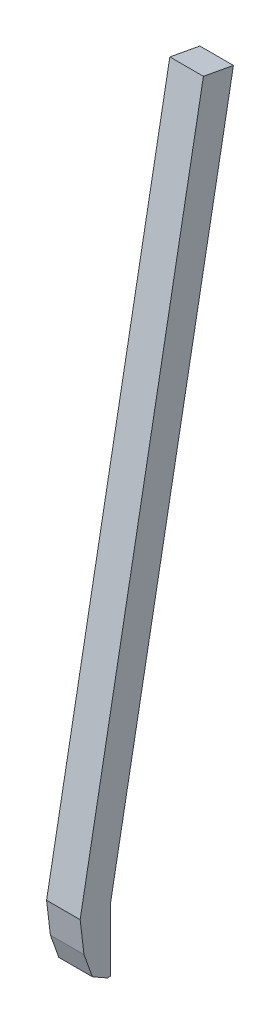
from build123d import *

# Parameters (mm, degrees)
SKETCH3_W                = 11
SKETCH3_H                = 21
BOSS_EXTRUDE1_DEPTH      = 10
CUT_EXTRUDE1_DEPTH       = 8
CUT_EXTRUDE5_DEPTH       = 8
CUT_EXTRUDE5_DEPTH_BACK  = 8
BOSS_EXTRUDE2_DEPTH      = 5.5
BOSS_EXTRUDE2_DEPTH_BACK = 5.5


with BuildPart() as part:
    # Sketch3 → Boss-Extrude1 (new body)
    with BuildSketch(Plane.XY):
        Rectangle(SKETCH3_W, SKETCH3_H)
    extrude(amount=BOSS_EXTRUDE1_DEPTH)

    # Sketch5 → Cut-Extrude1 (cut)
    with BuildSketch(Plane.XY):
        Polygon((0, 1.5), (-2, 1.5), (-2, -1.5), (2, -1.5), (2, 1.5), align=None)
    extrude(amount=CUT_EXTRUDE1_DEPTH, mode=Mode.SUBTRACT)

    # Sketch6 → Cut-Extrude5 (cut, two sides: drawn at the far end of the back side and taken through both)
    with BuildSketch(Plane(origin=(0, 0, 0), x_dir=(0, 0, -1), z_dir=(1, 0, 0)).offset(-CUT_EXTRUDE5_DEPTH_BACK)):
        Polygon((-1.0867085, -10.5), (-6.011599163, -7.693477847), (-8.753565317, 0), (-10, 10.5), (-10, -10.5), (-10, -11.324459918), (-1.0867085, -10.760658811), align=None)
    extrude(amount=CUT_EXTRUDE5_DEPTH + CUT_EXTRUDE5_DEPTH_BACK, mode=Mode.SUBTRACT)

    # Sketch18 → Boss-Extrude2 (add, two sides: drawn at the far end of the back side and taken through both)
    with BuildSketch(Plane(origin=(0, 0, 0), x_dir=(0, 0, -1), z_dir=(1, 0, 0)).offset(-BOSS_EXTRUDE2_DEPTH_BACK)):
        Polygon((0, 10.5), (40.195441972, 227.697760834), (30.362408276, 229.51749937), (-10, 10.5), align=None)
    extrude(amount=BOSS_EXTRUDE2_DEPTH + BOSS_EXTRUDE2_DEPTH_BACK)


solid = part.part
